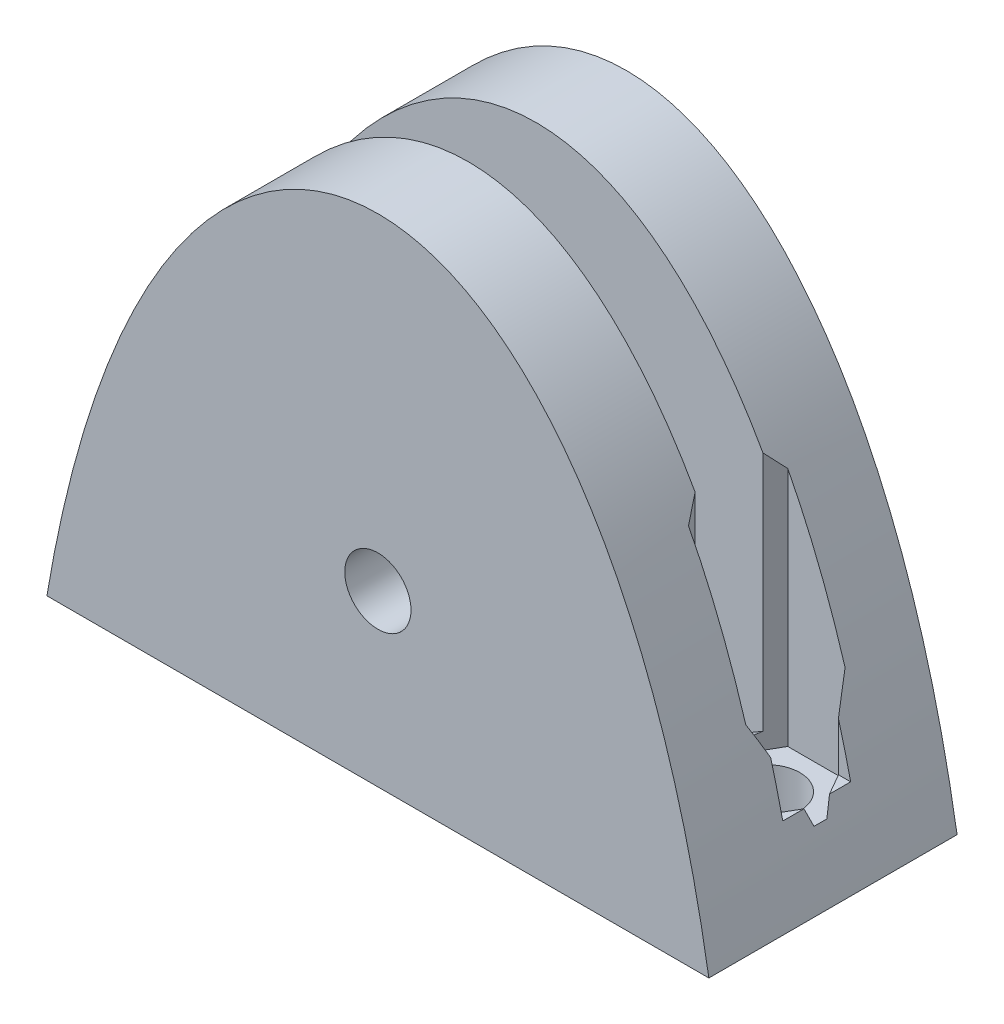
from build123d import *

# Parameters (mm, degrees)
BOSS_EXTRUDE1_DEPTH = 15
CUT_EXTRUDE1_REACH  = 41.051
SKETCH2_R           = 2
CUT_EXTRUDE2_REACH  = 38.069
SKETCH4_R           = 2
CUT_EXTRUDE3_DEPTH  = 15
SKETCH5_W           = 40
SKETCH5_H           = 4.1
CUT_EXTRUDE4_DEPTH  = 26
CUT_EXTRUDE6_REACH  = 39.299


with BuildPart() as part:
    # Sketch1 → Boss-Extrude1 (new body)
    with BuildSketch(Plane.XY):
        with BuildLine():
            Line((-20, 0), (20, 0))
            add(Edge.make_bspline(
                [(-20, 0), (-15, 30), (0, 40), (15, 30), (20, 0)],
                knots=[0, 0, 0, 0, 0, 1, 1, 1, 1, 1], degree=4))
        make_face()
    extrude(amount=BOSS_EXTRUDE1_DEPTH)

    # Sketch2 → Cut-Extrude1 (cut, up to next)
    with BuildSketch(Plane.XZ, mode=Mode.PRIVATE) as cut_extrude1_sk1:
        with Locations((16, 7.5)):
            Circle(SKETCH2_R)
    cut_extrude1_tool1 = extrude(cut_extrude1_sk1.sketch, amount=-CUT_EXTRUDE1_REACH, mode=Mode.PRIVATE) & part.part
    # Sketch2 → Cut-Extrude1 (cut, up to next)
    with BuildSketch(Plane.XZ, mode=Mode.PRIVATE) as cut_extrude1_sk2:
        with Locations((-16, 7.5)):
            Circle(SKETCH2_R)
    cut_extrude1_tool2 = extrude(cut_extrude1_sk2.sketch, amount=-CUT_EXTRUDE1_REACH, mode=Mode.PRIVATE) & part.part
    add(cut_extrude1_tool1.solids().sort_by_distance((16, 0, 7.5))[0], mode=Mode.SUBTRACT)
    add(cut_extrude1_tool2.solids().sort_by_distance((-16, 0, 7.5))[0], mode=Mode.SUBTRACT)

    # Sketch3 → Cut-Extrude2 (cut, up to next)
    with BuildSketch(Plane(origin=(0, 4, 0), x_dir=(-1, 0, 0), z_dir=(0, -1, 0)), mode=Mode.PRIVATE) as cut_extrude2_sk1:
        Polygon((17.732050808, -4.5), (14.267949192, -4.5), (12.535898385, -7.5), (14.267949192, -10.5), (17.732050808, -10.5), (19.464101615, -7.5), align=None)
    cut_extrude2_tool1 = extrude(cut_extrude2_sk1.sketch, amount=-CUT_EXTRUDE2_REACH, mode=Mode.PRIVATE) & part.part
    # Sketch3 → Cut-Extrude2 (cut, up to next)
    with BuildSketch(Plane(origin=(0, 4, 0), x_dir=(-1, 0, 0), z_dir=(0, -1, 0)), mode=Mode.PRIVATE) as cut_extrude2_sk2:
        Polygon((-17.732050808, -4.5), (-19.464101615, -7.5), (-17.732050808, -10.5), (-14.267949192, -10.5), (-12.535898385, -7.5), (-14.267949192, -4.5), align=None)
    cut_extrude2_tool2 = extrude(cut_extrude2_sk2.sketch, amount=-CUT_EXTRUDE2_REACH, mode=Mode.PRIVATE) & part.part
    add(cut_extrude2_tool1.solids().sort_by_distance((-16, 4, 7.5))[0], mode=Mode.SUBTRACT)
    add(cut_extrude2_tool2.solids().sort_by_distance((16, 4, 7.5))[0], mode=Mode.SUBTRACT)

    # Sketch4 → Cut-Extrude3 (cut)
    with BuildSketch(Plane.XY.offset(15)):
        with Locations((0, 10.25)):
            Circle(SKETCH4_R)
    extrude(amount=-CUT_EXTRUDE3_DEPTH, mode=Mode.SUBTRACT)

    # Sketch5 → Cut-Extrude4 (cut)
    with BuildSketch(Plane(origin=(0, 31, 0), x_dir=(1, 0, 0), z_dir=(0, 1, 0))):
        with Locations((0, -7.5)):
            Rectangle(SKETCH5_W, SKETCH5_H)
    extrude(amount=-CUT_EXTRUDE4_DEPTH, mode=Mode.SUBTRACT)

    # Cut-Extrude6: up to this face of the body (flat: up to its plane)
    cut_extrude6_end = Plane(part.part.faces().sort_by_distance((3.91e-07, 16.202361225, 5.45))[0])
    # Sketch7 → Cut-Extrude6 (cut, up to the picked face)
    with BuildSketch(Plane(origin=(0, 0, 9.55), x_dir=(-1, 0, 0), z_dir=(0, 0, -1)), mode=Mode.PRIVATE) as cut_extrude6_sk1:
        with BuildLine():
            Line((13.719466437, 5), (13.719466437, 6.244656836))
            Line((13.719466437, 6.244656836), (-13.719466437, 6.244656836))
            Line((-13.719466437, 6.244656836), (-13.719466437, 5))
            ThreePointArc((-13.719466437, 5), (0, 1.028956083), (13.719466437, 5))
        make_face()
    cut_extrude6_tool1 = split(extrude(cut_extrude6_sk1.sketch, amount=CUT_EXTRUDE6_REACH, mode=Mode.PRIVATE), bisect_by=cut_extrude6_end, keep=Keep.BOTH, mode=Mode.PRIVATE)
    add(cut_extrude6_tool1.solids().sort_by(Axis((0, 4.103163, 9.55), (0, 0, -1)))[0], mode=Mode.SUBTRACT)


solid = part.part
